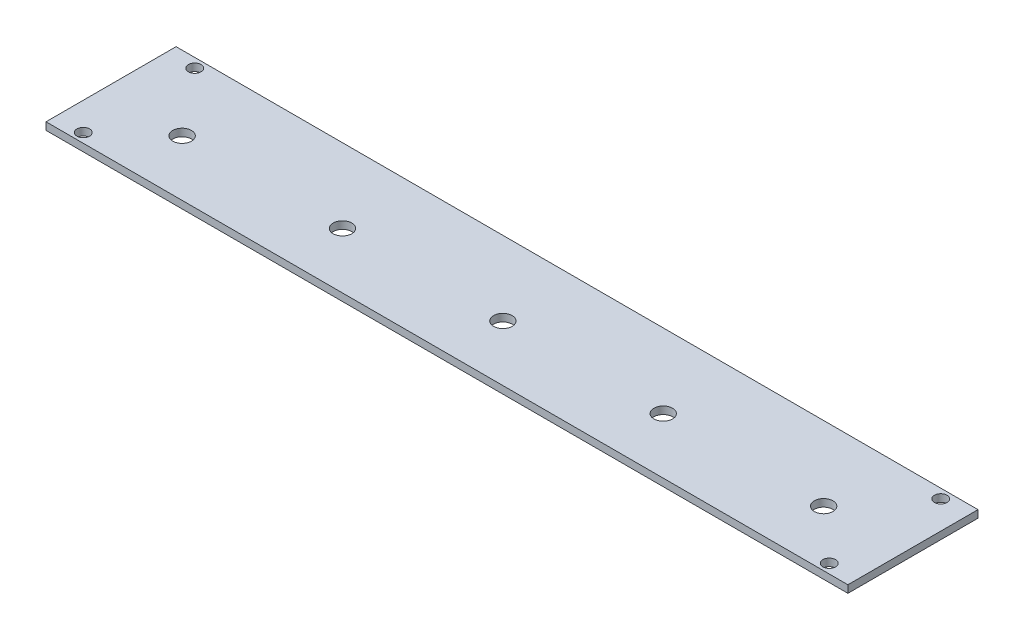
from build123d import *

# Parameters (mm, degrees)
SKETCH2_W            = 215.1
SKETCH2_H            = 34.9
BOSS_EXTRUDE1_DEPTH  = 2
M3_CLEARANCE_HOLE1_D = 3.4
CUT_EXTRUDE1_REACH   = 136.214
SKETCH7_R            = 2.5


with BuildPart() as part:
    # Sketch2 → Boss-Extrude1 (new body)
    with BuildSketch(Plane(origin=(0, 0, 0), x_dir=(1, 0, 0), z_dir=(0, 1, 0))):
        with Locations((-22.149288499, -17.010354253)):
            Rectangle(SKETCH2_W, SKETCH2_H)
    extrude(amount=BOSS_EXTRUDE1_DEPTH)

    # M3 Clearance Hole1 (through all)
    with Locations(Plane(origin=(0, 2, 0), x_dir=(1, 0, 0), z_dir=(0, 1, 0))):
        with Locations((-122.199288499, -2.060354253), (-122.199288499, -31.960354253), (77.900711501, -2.060354253), (77.900711501, -31.960354253)):
            Hole(M3_CLEARANCE_HOLE1_D / 2)

    # Sketch7 → Cut-Extrude1 (cut, up to next)
    with BuildSketch(Plane.XZ, mode=Mode.PRIVATE) as cut_extrude1_sk1:
        with Locations(Location((-108.189288499, 19.460354253, 0), (0, 0, 270))):
            Circle(SKETCH7_R)
    cut_extrude1_tool1 = extrude(cut_extrude1_sk1.sketch, amount=-CUT_EXTRUDE1_REACH, mode=Mode.PRIVATE) & part.part
    # Sketch7 → Cut-Extrude1 (cut, up to next)
    with BuildSketch(Plane.XZ, mode=Mode.PRIVATE) as cut_extrude1_sk2:
        with Locations(Location((-65.169288499, 19.460354253, 0), (0, 0, 270))):
            Circle(SKETCH7_R)
    cut_extrude1_tool2 = extrude(cut_extrude1_sk2.sketch, amount=-CUT_EXTRUDE1_REACH, mode=Mode.PRIVATE) & part.part
    # Sketch7 → Cut-Extrude1 (cut, up to next)
    with BuildSketch(Plane.XZ, mode=Mode.PRIVATE) as cut_extrude1_sk3:
        with Locations(Location((-22.149288499, 19.460354253, 0), (0, 0, 270))):
            Circle(SKETCH7_R)
    cut_extrude1_tool3 = extrude(cut_extrude1_sk3.sketch, amount=-CUT_EXTRUDE1_REACH, mode=Mode.PRIVATE) & part.part
    # Sketch7 → Cut-Extrude1 (cut, up to next)
    with BuildSketch(Plane.XZ, mode=Mode.PRIVATE) as cut_extrude1_sk4:
        with Locations(Location((20.870711501, 19.460354253, 0), (0, 0, 270))):
            Circle(SKETCH7_R)
    cut_extrude1_tool4 = extrude(cut_extrude1_sk4.sketch, amount=-CUT_EXTRUDE1_REACH, mode=Mode.PRIVATE) & part.part
    # Sketch7 → Cut-Extrude1 (cut, up to next)
    with BuildSketch(Plane.XZ, mode=Mode.PRIVATE) as cut_extrude1_sk5:
        with Locations(Location((63.890711501, 19.460354253, 0), (0, 0, 270))):
            Circle(SKETCH7_R)
    cut_extrude1_tool5 = extrude(cut_extrude1_sk5.sketch, amount=-CUT_EXTRUDE1_REACH, mode=Mode.PRIVATE) & part.part
    add(cut_extrude1_tool1.solids().sort_by_distance((-108.189288, 0, 19.460354))[0], mode=Mode.SUBTRACT)
    add(cut_extrude1_tool2.solids().sort_by_distance((-65.169288, 0, 19.460354))[0], mode=Mode.SUBTRACT)
    add(cut_extrude1_tool3.solids().sort_by_distance((-22.149288, 0, 19.460354))[0], mode=Mode.SUBTRACT)
    add(cut_extrude1_tool4.solids().sort_by_distance((20.870712, 0, 19.460354))[0], mode=Mode.SUBTRACT)
    add(cut_extrude1_tool5.solids().sort_by_distance((63.890712, 0, 19.460354))[0], mode=Mode.SUBTRACT)


solid = part.part
